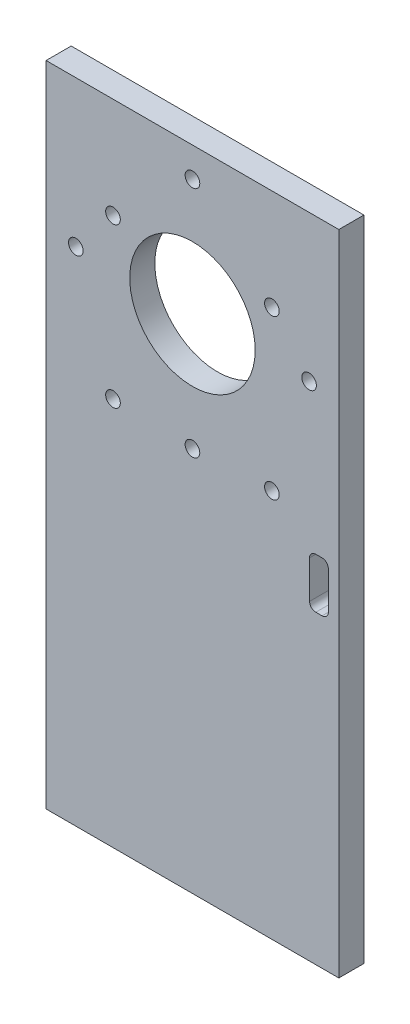
from build123d import *

# Parameters (mm, degrees)
SKETCH1_W           = 70
SKETCH1_H           = 155
BOSS_EXTRUDE1_DEPTH = 6
SKETCH3_R           = 15
CUT_EXTRUDE1_DEPTH  = 86.248167136
SKETCH4_R           = 1.75
CUT_EXTRUDE2_DEPTH  = 86.248167136
CUT_EXTRUDE3_DEPTH  = 86.248167136
SKETCH8_R           = 1.75
CUT_EXTRUDE6_DEPTH  = 86.248167136


with BuildPart() as part:
    # Sketch1 → Boss-Extrude1 (new body)
    with BuildSketch(Plane.XY):
        Rectangle(SKETCH1_W, SKETCH1_H)
    extrude(amount=BOSS_EXTRUDE1_DEPTH)

    # Sketch3 → Cut-Extrude1 (cut, through all)
    with BuildSketch(Plane.XY.offset(6)):
        with Locations((0, 42.5)):
            Circle(SKETCH3_R)
    extrude(amount=-CUT_EXTRUDE1_DEPTH, mode=Mode.SUBTRACT)

    # Sketch4 → Cut-Extrude2 (cut, through all)
    with BuildSketch(Plane(origin=(0, 0, 0), x_dir=(-1, 0, 0), z_dir=(0, 0, -1))):
        with Locations((-19, 53.4)):
            Circle(SKETCH4_R)
        with Locations((19, 53.4)):
            Circle(SKETCH4_R)
        with Locations((-19, 15.4)):
            Circle(SKETCH4_R)
        with Locations((19, 15.4)):
            Circle(SKETCH4_R)
    extrude(amount=-CUT_EXTRUDE2_DEPTH, mode=Mode.SUBTRACT)

    # Sketch5 → Cut-Extrude3 (cut, through all)
    with BuildSketch(Plane.XY.offset(6)):
        with BuildLine():
            Line((29.5, 7.5), (31, 7.5))
            ThreePointArc((31, 7.5), (32.060660172, 7.060660172), (32.5, 6))
            Line((32.5, 6), (32.5, -3))
            ThreePointArc((32.5, -3), (32.060660172, -4.060660172), (31, -4.5))
            Line((31, -4.5), (29.5, -4.5))
            ThreePointArc((29.5, -4.5), (28.439339828, -4.060660172), (28, -3))
            Line((28, -3), (28, 6))
            ThreePointArc((28, 6), (28.439339828, 7.060660172), (29.5, 7.5))
        make_face()
    extrude(amount=-CUT_EXTRUDE3_DEPTH, mode=Mode.SUBTRACT)

    # Sketch8 → Cut-Extrude6 (cut, through all)
    with BuildSketch(Plane.XY.offset(6)):
        with Locations((-27.888022688, 42.5)):
            Circle(SKETCH8_R)
        with Locations((0, 14.611977312)):
            Circle(SKETCH8_R)
        with Locations((27.888022688, 42.5)):
            Circle(SKETCH8_R)
        with Locations((0, 70.388022688)):
            Circle(SKETCH8_R)
    extrude(amount=-CUT_EXTRUDE6_DEPTH, mode=Mode.SUBTRACT)


solid = part.part
